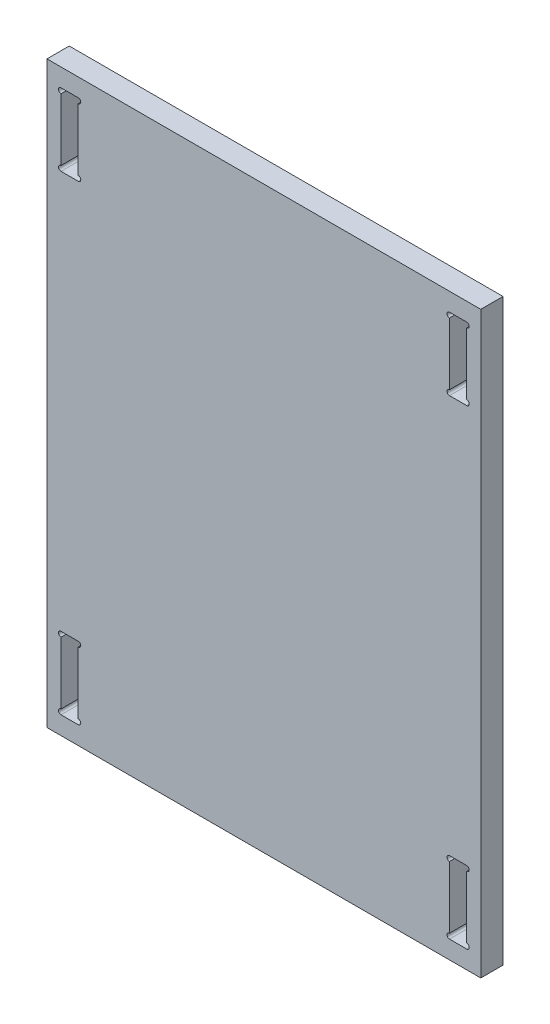
from build123d import *

# Parameters (mm, degrees)
SKETCH1_W           = 600
SKETCH1_H           = 801
BOSS_EXTRUDE1_DEPTH = 30.8


with BuildPart() as part:
    # Sketch1 → Boss-Extrude1 (new body)
    with BuildSketch(Plane(origin=(0, 0, 1970), x_dir=(-1, 0, 0), z_dir=(0, 0, -1))):
        with Locations((0, 24.5)):
            Rectangle(SKETCH1_W, SKETCH1_H)
        with BuildLine():
            Line((256.75, 393), (256.75, 307))
            ThreePointArc((256.75, 307), (253.25, 303.5), (256.75, 300))
            Line((256.75, 300), (280.55, 300))
            ThreePointArc((280.55, 300), (284.05, 303.5), (280.55, 307))
            Line((280.55, 307), (280.55, 393))
            ThreePointArc((280.55, 393), (284.05, 396.5), (280.55, 400))
            Line((280.55, 400), (256.75, 400))
            ThreePointArc((256.75, 400), (253.25, 396.5), (256.75, 393))
        make_face(mode=Mode.SUBTRACT)
        with BuildLine():
            Line((-256.75, 300), (-280.55, 300))
            ThreePointArc((-280.55, 300), (-284.05, 303.5), (-280.55, 307))
            Line((-280.55, 307), (-280.55, 393))
            ThreePointArc((-280.55, 393), (-284.05, 396.5), (-280.55, 400))
            Line((-280.55, 400), (-256.75, 400))
            ThreePointArc((-256.75, 400), (-253.25, 396.5), (-256.75, 393))
            Line((-256.75, 393), (-256.75, 307))
            ThreePointArc((-256.75, 307), (-253.25, 303.5), (-256.75, 300))
        make_face(mode=Mode.SUBTRACT)
        with BuildLine():
            Line((-256.75, -344), (-256.75, -258))
            ThreePointArc((-256.75, -258), (-253.25, -254.5), (-256.75, -251))
            Line((-256.75, -251), (-280.55, -251))
            ThreePointArc((-280.55, -251), (-284.05, -254.5), (-280.55, -258))
            Line((-280.55, -258), (-280.55, -344))
            ThreePointArc((-280.55, -344), (-284.05, -347.5), (-280.55, -351))
            Line((-280.55, -351), (-256.75, -351))
            ThreePointArc((-256.75, -351), (-253.25, -347.5), (-256.75, -344))
        make_face(mode=Mode.SUBTRACT)
        with BuildLine():
            Line((256.75, -251), (280.55, -251))
            ThreePointArc((280.55, -251), (284.05, -254.5), (280.55, -258))
            Line((280.55, -258), (280.55, -344))
            ThreePointArc((280.55, -344), (284.05, -347.5), (280.55, -351))
            Line((280.55, -351), (256.75, -351))
            ThreePointArc((256.75, -351), (253.25, -347.5), (256.75, -344))
            Line((256.75, -344), (256.75, -258))
            ThreePointArc((256.75, -258), (253.25, -254.5), (256.75, -251))
        make_face(mode=Mode.SUBTRACT)
    extrude(amount=-BOSS_EXTRUDE1_DEPTH)


solid = part.part
